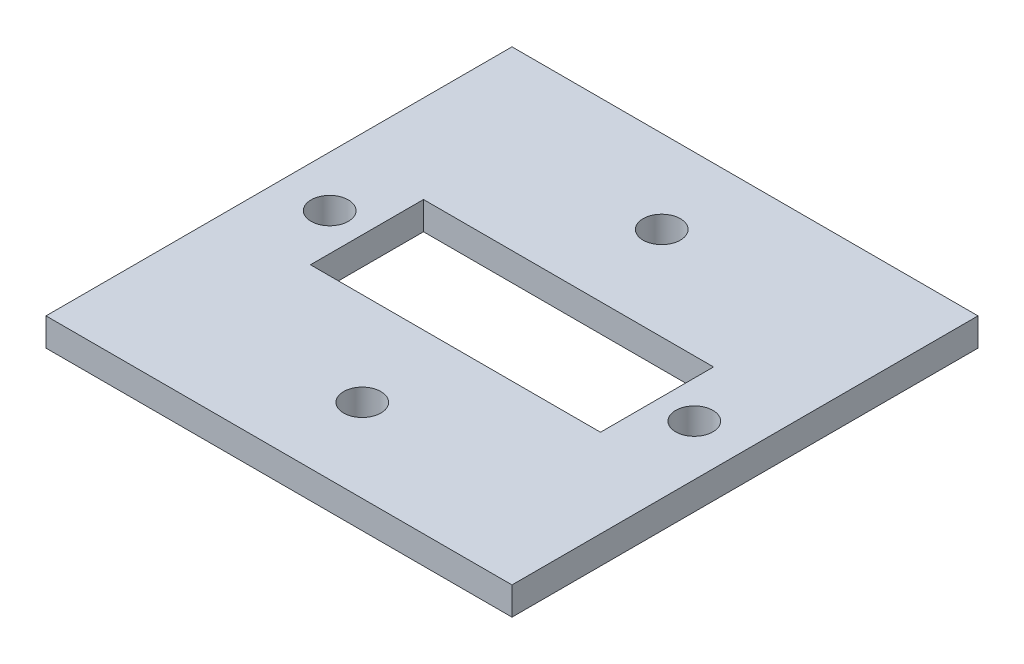
from build123d import *

# Parameters (mm, degrees)
ESBO_O1_W             = 50
ESBO_O1_H             = 50
BASE_DEPTH            = 3
ENTRADASESB_R         = 2
ENTRADASESB_W         = 31.12
ENTRADASESB_H         = 12.13
CORTE_EXTRUS_O1_DEPTH = 3


with BuildPart() as part:
    # Esboço1 → Base (new body)
    with BuildSketch(Plane(origin=(0, 0, 0), x_dir=(1, 0, 0), z_dir=(0, 1, 0))):
        with Locations((25, 25)):
            Rectangle(ESBO_O1_W, ESBO_O1_H)
    extrude(amount=BASE_DEPTH)

    # EntradasEsb → Corte-extrusão1 (cut)
    with BuildSketch(Plane(origin=(0, 3, 0), x_dir=(1, 0, 0), z_dir=(0, 1, 0))):
        with Locations(Location((25, 41.065, 0), (0, 0, 270))):
            Circle(ENTRADASESB_R)
        with Locations(Location((25, 8.935, 0), (0, 0, 270))):
            Circle(ENTRADASESB_R)
        with Locations(Location((44.56, 25, 0), (0, 0, 270))):
            Circle(ENTRADASESB_R)
        with Locations(Location((5.44, 25, 0), (0, 0, 270))):
            Circle(ENTRADASESB_R)
        with Locations((25, 25)):
            Rectangle(ENTRADASESB_W, ENTRADASESB_H)
    extrude(amount=-CORTE_EXTRUS_O1_DEPTH, mode=Mode.SUBTRACT)


solid = part.part
